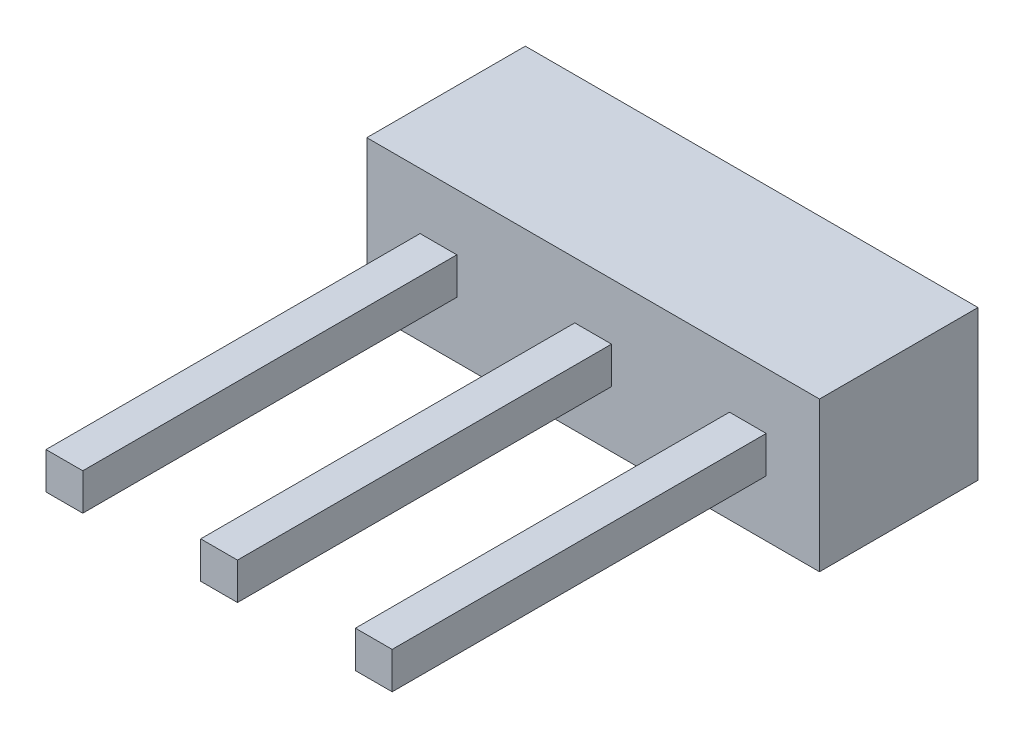
from build123d import *

# Parameters (mm, degrees)
SKICA1_W                = 7.14
SKICA1_H                = 2.36
P_IDAT_VYSUNUT_M1_DEPTH = 2.5
SKICA2_W                = 0.58
SKICA2_H                = 0.58
P_IDAT_VYSUNUT_M2_DEPTH = 5.9
LINPOLE1_COUNT          = 3
LINPOLE1_PITCH          = 2.44


with BuildPart() as part:
    # Skica1 → Přidat vysunutím1 (new body)
    with BuildSketch(Plane.XY):
        Rectangle(SKICA1_W, SKICA1_H)
    extrude(amount=P_IDAT_VYSUNUT_M1_DEPTH)

    # Skica2 → Přidat vysunutím2 (add)
    with BuildSketch(Plane.XY.offset(2.5)):
        with Locations((2.44, 0)):
            Rectangle(SKICA2_W, SKICA2_H)
    p_idat_vysunut_m2 = extrude(amount=P_IDAT_VYSUNUT_M2_DEPTH)

    # LinPole1: Přidat vysunutím2 ×3
    with Locations(*[(-i * LINPOLE1_PITCH, 0, 0) for i in range(1, LINPOLE1_COUNT)]):
        add(p_idat_vysunut_m2)


solid = part.part
